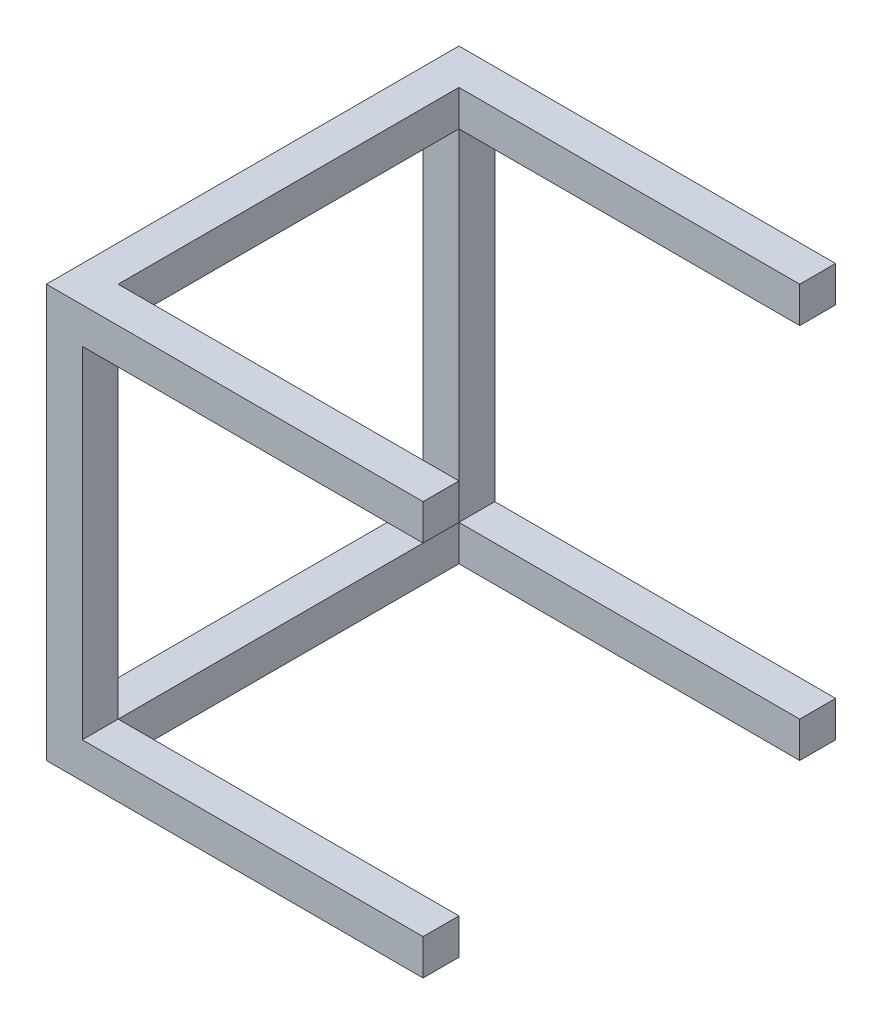
from build123d import *

# Parameters (mm, degrees)
SKETCH_1_W      = 460
SKETCH_1_H      = 460
SKETCH_1_W_2    = 380
SKETCH_1_H_2    = 380
EXTRUDE_2_DEPTH = 40
SKETCH_2_W      = 40
SKETCH_2_H      = 40
EXTRUDE_3_DEPTH = 380


with BuildPart() as part:
    # 草图1 → 凸台-拉伸2 (new body)
    with BuildSketch(Plane(origin=(0, 0, 0), x_dir=(0, 0, -1), z_dir=(1, 0, 0))):
        with Locations((230, 255.532389843)):
            Rectangle(SKETCH_1_W, SKETCH_1_H)
        with Locations((230, 255.532389843)):
            Rectangle(SKETCH_1_W_2, SKETCH_1_H_2, mode=Mode.SUBTRACT)
    extrude(amount=EXTRUDE_2_DEPTH)

    # 草图2 → 凸台-拉伸3 (add)
    with BuildSketch(Plane(origin=(40, 0, 0), x_dir=(0, 0, -1), z_dir=(1, 0, 0))):
        with Locations((20, 465.532389843)):
            Rectangle(SKETCH_2_W, SKETCH_2_H)
        with Locations((440, 465.532389843)):
            Rectangle(SKETCH_2_W, SKETCH_2_H)
        with Locations((440, 45.532389843)):
            Rectangle(SKETCH_2_W, SKETCH_2_H)
        with Locations((20, 45.532389843)):
            Rectangle(SKETCH_2_W, SKETCH_2_H)
    extrude(amount=EXTRUDE_3_DEPTH)


solid = part.part
